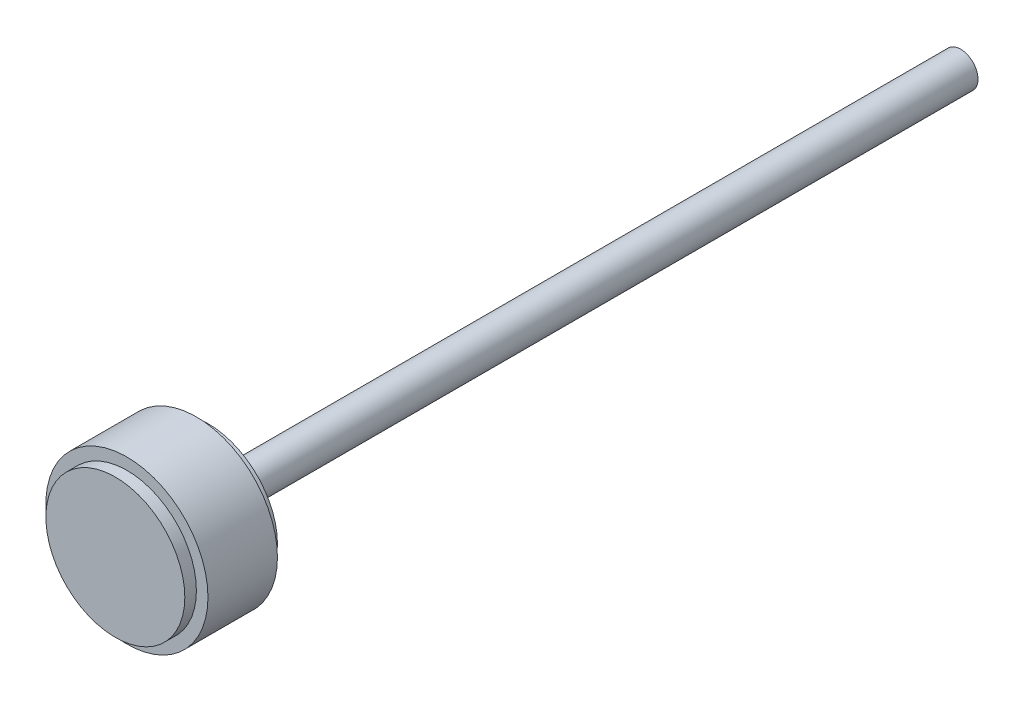
from build123d import *

# Parameters (mm, degrees)
SKETCH1_R           = 7.5
BOSS_EXTRUDE1_DEPTH = 320
SKETCH2_R           = 10
BOSS_EXTRUDE2_DEPTH = 5
SKETCH3_R           = 30
BOSS_EXTRUDE3_DEPTH = 5
SKETCH4_R           = 35
SKETCH4_R_2         = 30
BOSS_EXTRUDE4_DEPTH = 30
SKETCH5_R           = 30
BOSS_EXTRUDE5_DEPTH = 5


with BuildPart() as part:
    # Sketch1 → Boss-Extrude1 (new body)
    with BuildSketch(Plane.XY):
        Circle(SKETCH1_R)
    extrude(amount=-BOSS_EXTRUDE1_DEPTH)

    # Sketch2 → Boss-Extrude2 (add)
    with BuildSketch(Plane.XY):
        Circle(SKETCH2_R)
    extrude(amount=BOSS_EXTRUDE2_DEPTH)

    # Sketch3 → Boss-Extrude3 (add)
    with BuildSketch(Plane.XY.offset(5)):
        Circle(SKETCH3_R)
    extrude(amount=BOSS_EXTRUDE3_DEPTH)

    # Sketch4 → Boss-Extrude4 (add)
    # profile 1 of 2: a face of its own
    with BuildSketch(Plane.XY.offset(10)):
        Circle(SKETCH4_R)
        Circle(SKETCH4_R_2, mode=Mode.SUBTRACT)
    # profile 2 of 2: a face of its own
    with BuildSketch(Plane.XY.offset(10)):
        Circle(SKETCH4_R_2)
    extrude(amount=BOSS_EXTRUDE4_DEPTH)

    # Sketch5 → Boss-Extrude5 (add)
    with BuildSketch(Plane.XY.offset(40)):
        Circle(SKETCH5_R)
    extrude(amount=BOSS_EXTRUDE5_DEPTH)


solid = part.part
